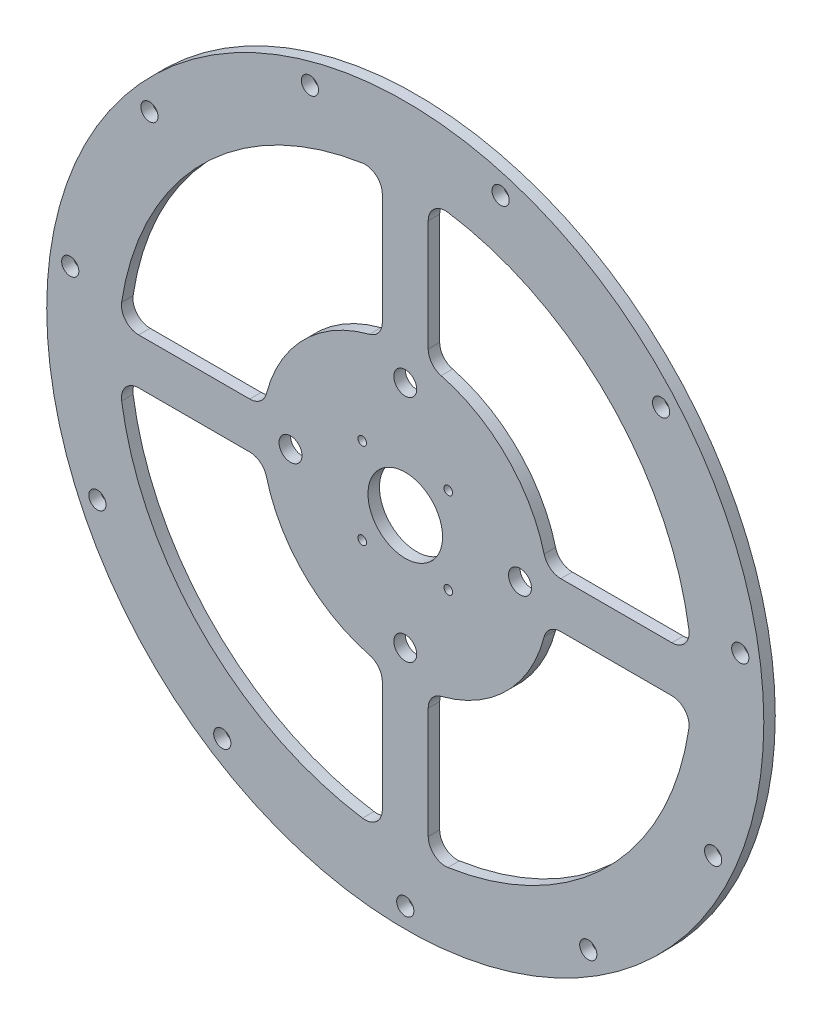
from build123d import *

# Parameters (mm, degrees)
SKETCH_1_R      = 62.5
SKETCH_1_R_2    = 2
SKETCH_1_R_3    = 1.5
SKETCH_1_R_4    = 6.5
SKETCH_1_R_5    = 0.75
EXTRUDE_1_DEPTH = 2


with BuildPart() as part:
    # 草图1 → 凸台-拉伸1 (new body)
    with BuildSketch(Plane.XY):
        Circle(SKETCH_1_R)
        with Locations((0, -20)):
            Circle(SKETCH_1_R_2, mode=Mode.SUBTRACT)
        with Locations((0, -59)):
            Circle(SKETCH_1_R_3, mode=Mode.SUBTRACT)
        with Locations((-20, 0)):
            Circle(SKETCH_1_R_2, mode=Mode.SUBTRACT)
        with Locations((0, 20)):
            Circle(SKETCH_1_R_2, mode=Mode.SUBTRACT)
        with Locations((20, 0)):
            Circle(SKETCH_1_R_2, mode=Mode.SUBTRACT)
        with Locations((-31.89780823, -49.633958437)):
            Circle(SKETCH_1_R_3, mode=Mode.SUBTRACT)
        with Locations((-53.668287726, -24.509485767)):
            Circle(SKETCH_1_R_3, mode=Mode.SUBTRACT)
        with Locations((-58.399465071, 8.396575458)):
            Circle(SKETCH_1_R_3, mode=Mode.SUBTRACT)
        with Locations((-44.589224887, 38.636783303)):
            Circle(SKETCH_1_R_3, mode=Mode.SUBTRACT)
        with Locations((-16.622220854, 56.610085443)):
            Circle(SKETCH_1_R_3, mode=Mode.SUBTRACT)
        with Locations((16.622220854, 56.610085443)):
            Circle(SKETCH_1_R_3, mode=Mode.SUBTRACT)
        with Locations((44.589224887, 38.636783303)):
            Circle(SKETCH_1_R_3, mode=Mode.SUBTRACT)
        with Locations((58.399465071, 8.396575458)):
            Circle(SKETCH_1_R_3, mode=Mode.SUBTRACT)
        with Locations((53.668287726, -24.509485767)):
            Circle(SKETCH_1_R_3, mode=Mode.SUBTRACT)
        with Locations((31.89780823, -49.633958437)):
            Circle(SKETCH_1_R_3, mode=Mode.SUBTRACT)
        Circle(SKETCH_1_R_4, mode=Mode.SUBTRACT)
        with Locations((-7.498513861, -7.498513861)):
            Circle(SKETCH_1_R_5, mode=Mode.SUBTRACT)
        with Locations((-7.498513861, 7.498513861)):
            Circle(SKETCH_1_R_5, mode=Mode.SUBTRACT)
        with Locations((7.498513861, 7.498513861)):
            Circle(SKETCH_1_R_5, mode=Mode.SUBTRACT)
        with Locations((7.498513861, -7.498513861)):
            Circle(SKETCH_1_R_5, mode=Mode.SUBTRACT)
        with BuildLine():
            Line((-46.475800154, 4), (-27.110883423, 4))
            ThreePointArc((-27.110883423, 4), (-25.273766116, 4.628291755), (-24.206145914, 6.25))
            ThreePointArc((-24.206145914, 6.25), (-17.67766953, 17.67766953), (-6.25, 24.206145914))
            ThreePointArc((-6.25, 24.206145914), (-4.628291755, 25.273766116), (-4, 27.110883423))
            Line((-4, 27.110883423), (-4, 46.475800154))
            ThreePointArc((-4, 46.475800154), (-5.043015781, 48.749610341), (-7.446808511, 49.44234059))
            ThreePointArc((-7.446808511, 49.44234059), (-35.355339059, 35.355339059), (-49.44234059, 7.446808511))
            ThreePointArc((-49.44234059, 7.446808511), (-48.749610341, 5.043015781), (-46.475800154, 4))
        make_face(mode=Mode.SUBTRACT)
        with BuildLine():
            Line((4, 46.475800154), (4, 27.110883423))
            ThreePointArc((4, 27.110883423), (4.628291755, 25.273766116), (6.25, 24.206145914))
            ThreePointArc((6.25, 24.206145914), (17.67766953, 17.67766953), (24.206145914, 6.25))
            ThreePointArc((24.206145914, 6.25), (25.273766116, 4.628291755), (27.110883423, 4))
            Line((27.110883423, 4), (46.475800154, 4))
            ThreePointArc((46.475800154, 4), (48.749610341, 5.043015781), (49.44234059, 7.446808511))
            ThreePointArc((49.44234059, 7.446808511), (35.355339059, 35.355339059), (7.446808511, 49.44234059))
            ThreePointArc((7.446808511, 49.44234059), (5.043015781, 48.749610341), (4, 46.475800154))
        make_face(mode=Mode.SUBTRACT)
        with BuildLine():
            Line((-27.110883423, -4), (-46.475800154, -4))
            ThreePointArc((-46.475800154, -4), (-48.749610341, -5.043015781), (-49.44234059, -7.446808511))
            ThreePointArc((-49.44234059, -7.446808511), (-35.355339059, -35.355339059), (-7.446808511, -49.44234059))
            ThreePointArc((-7.446808511, -49.44234059), (-5.043015781, -48.749610341), (-4, -46.475800154))
            Line((-4, -46.475800154), (-4, -27.110883423))
            ThreePointArc((-4, -27.110883423), (-4.628291755, -25.273766116), (-6.25, -24.206145914))
            ThreePointArc((-6.25, -24.206145914), (-17.67766953, -17.67766953), (-24.206145914, -6.25))
            ThreePointArc((-24.206145914, -6.25), (-25.273766116, -4.628291755), (-27.110883423, -4))
        make_face(mode=Mode.SUBTRACT)
        with BuildLine():
            Line((46.475800154, -4), (27.110883423, -4))
            ThreePointArc((27.110883423, -4), (25.273766116, -4.628291755), (24.206145914, -6.25))
            ThreePointArc((24.206145914, -6.25), (17.67766953, -17.67766953), (6.25, -24.206145914))
            ThreePointArc((6.25, -24.206145914), (4.628291755, -25.273766116), (4, -27.110883423))
            Line((4, -27.110883423), (4, -46.475800154))
            ThreePointArc((4, -46.475800154), (5.043015781, -48.749610341), (7.446808511, -49.44234059))
            ThreePointArc((7.446808511, -49.44234059), (35.355339059, -35.355339059), (49.44234059, -7.446808511))
            ThreePointArc((49.44234059, -7.446808511), (48.749610341, -5.043015781), (46.475800154, -4))
        make_face(mode=Mode.SUBTRACT)
    extrude(amount=EXTRUDE_1_DEPTH)


solid = part.part
